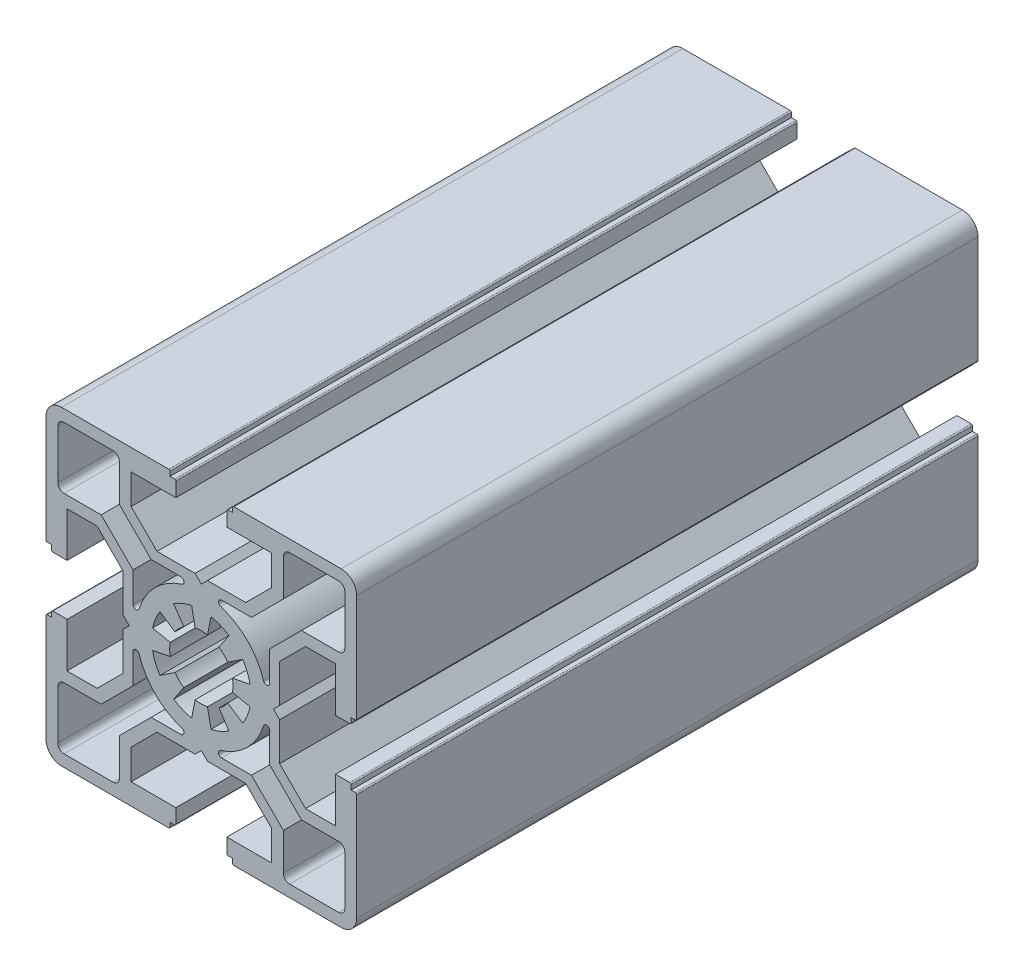
from build123d import *

# Parameters (mm, degrees)
EXTRUDE_1_DEPTH = 100


with BuildPart() as part:
    # 草图1 → 凸台-拉伸1 (new body)
    with BuildSketch(Plane.XY):
        with BuildLine():
            Line((-5.25, 25), (-22.5, 25))
            ThreePointArc((-22.5, 25), (-24.267766953, 24.267766953), (-25, 22.5))
            Line((-25, 22.5), (-25, 5.25))
            ThreePointArc((-25, 5.25), (-24.941421356, 5.108578644), (-24.8, 5.05))
            Line((-24.8, 5.05), (-24.1, 5.05))
            Line((-24.1, 5.05), (-24.1, 4.3))
            ThreePointArc((-24.1, 4.3), (-24.041421356, 4.158578644), (-23.9, 4.1))
            Line((-23.9, 4.1), (-21.6, 4.1))
            Line((-21.6, 4.1), (-21.6, 11.3))
            Line((-21.6, 11.3), (-16.769848481, 11.3))
            Line((-16.769848481, 11.3), (-12.6, 7.130151519))
            Line((-12.6, 7.130151519), (-12.6, 1))
            Line((-12.6, 1), (-11.6, 0))
            Line((-11.6, 0), (-12.6, -1))
            Line((-12.6, -1), (-12.6, -7.130151519))
            Line((-12.6, -7.130151519), (-16.769848481, -11.3))
            Line((-16.769848481, -11.3), (-21.6, -11.3))
            Line((-21.6, -11.3), (-21.6, -4.1))
            Line((-21.6, -4.1), (-23.9, -4.1))
            ThreePointArc((-23.9, -4.1), (-24.041421356, -4.158578644), (-24.1, -4.3))
            Line((-24.1, -4.3), (-24.1, -5.05))
            Line((-24.1, -5.05), (-24.8, -5.05))
            ThreePointArc((-24.8, -5.05), (-24.941421356, -5.108578644), (-25, -5.25))
            Line((-25, -5.25), (-25, -22.5))
            ThreePointArc((-25, -22.5), (-24.267766953, -24.267766953), (-22.5, -25))
            Line((-22.5, -25), (-5.25, -25))
            ThreePointArc((-5.25, -25), (-5.108578644, -24.941421356), (-5.05, -24.8))
            Line((-5.05, -24.8), (-5.05, -24.1))
            Line((-5.05, -24.1), (-4.3, -24.1))
            ThreePointArc((-4.3, -24.1), (-4.158578644, -24.041421356), (-4.1, -23.9))
            Line((-4.1, -23.9), (-4.1, -21.6))
            Line((-4.1, -21.6), (-11.3, -21.6))
            Line((-11.3, -21.6), (-11.3, -16.769848481))
            Line((-11.3, -16.769848481), (-7.130151519, -12.6))
            Line((-7.130151519, -12.6), (-1, -12.6))
            Line((-1, -12.6), (0, -11.6))
            Line((0, -11.6), (1, -12.6))
            Line((1, -12.6), (7.130151519, -12.6))
            Line((7.130151519, -12.6), (11.3, -16.769848481))
            Line((11.3, -16.769848481), (11.3, -21.6))
            Line((11.3, -21.6), (4.1, -21.6))
            Line((4.1, -21.6), (4.1, -23.9))
            ThreePointArc((4.1, -23.9), (4.158578644, -24.041421356), (4.3, -24.1))
            Line((4.3, -24.1), (5.05, -24.1))
            Line((5.05, -24.1), (5.05, -24.8))
            ThreePointArc((5.05, -24.8), (5.108578644, -24.941421356), (5.25, -25))
            Line((5.25, -25), (22.5, -25))
            ThreePointArc((22.5, -25), (24.267766953, -24.267766953), (25, -22.5))
            Line((25, -22.5), (25, -5.25))
            ThreePointArc((25, -5.25), (24.941421356, -5.108578644), (24.8, -5.05))
            Line((24.8, -5.05), (24.1, -5.05))
            Line((24.1, -5.05), (24.1, -4.3))
            ThreePointArc((24.1, -4.3), (24.041421356, -4.158578644), (23.9, -4.1))
            Line((23.9, -4.1), (21.6, -4.1))
            Line((21.6, -4.1), (21.6, -11.3))
            Line((21.6, -11.3), (16.769848481, -11.3))
            Line((16.769848481, -11.3), (12.6, -7.130151519))
            Line((12.6, -7.130151519), (12.6, -1))
            Line((12.6, -1), (11.6, 0))
            Line((11.6, 0), (12.6, 1))
            Line((12.6, 1), (12.6, 7.130151519))
            Line((12.6, 7.130151519), (16.769848481, 11.3))
            Line((16.769848481, 11.3), (21.6, 11.3))
            Line((21.6, 11.3), (21.6, 4.1))
            Line((21.6, 4.1), (23.9, 4.1))
            ThreePointArc((23.9, 4.1), (24.041421356, 4.158578644), (24.1, 4.3))
            Line((24.1, 4.3), (24.1, 5.05))
            Line((24.1, 5.05), (24.8, 5.05))
            ThreePointArc((24.8, 5.05), (24.941421356, 5.108578644), (25, 5.25))
            Line((25, 5.25), (25, 22.5))
            ThreePointArc((25, 22.5), (24.267766953, 24.267766953), (22.5, 25))
            Line((22.5, 25), (5.25, 25))
            ThreePointArc((5.25, 25), (5.108578644, 24.941421356), (5.05, 24.8))
            Line((5.05, 24.8), (5.05, 24.1))
            Line((5.05, 24.1), (4.3, 24.1))
            ThreePointArc((4.3, 24.1), (4.158578644, 24.041421356), (4.1, 23.9))
            Line((4.1, 23.9), (4.1, 21.6))
            Line((4.1, 21.6), (11.3, 21.6))
            Line((11.3, 21.6), (11.3, 16.769848481))
            Line((11.3, 16.769848481), (7.130151519, 12.6))
            Line((7.130151519, 12.6), (1, 12.6))
            Line((1, 12.6), (0, 11.6))
            Line((0, 11.6), (-1, 12.6))
            Line((-1, 12.6), (-7.130151519, 12.6))
            Line((-7.130151519, 12.6), (-11.3, 16.769848481))
            Line((-11.3, 16.769848481), (-11.3, 21.6))
            Line((-11.3, 21.6), (-4.1, 21.6))
            Line((-4.1, 21.6), (-4.1, 23.9))
            ThreePointArc((-4.1, 23.9), (-4.158578644, 24.041421356), (-4.3, 24.1))
            Line((-4.3, 24.1), (-5.05, 24.1))
            Line((-5.05, 24.1), (-5.05, 24.8))
            ThreePointArc((-5.05, 24.8), (-5.108578644, 24.941421356), (-5.25, 25))
        make_face()
        with BuildLine():
            Line((2.833408188, 4.240495023), (4.444561864, 6.651756898))
            ThreePointArc((4.444561864, 6.651756898), (3.061467459, 7.39103626), (1.560722576, 7.846282243))
            Line((1.560722576, 7.846282243), (0.994960642, 5.00200493))
            ThreePointArc((0.994960642, 5.00200493), (0, 5.1), (-0.994960642, 5.00200493))
            Line((-0.994960642, 5.00200493), (-1.560722576, 7.846282243))
            ThreePointArc((-1.560722576, 7.846282243), (-3.061467459, 7.39103626), (-4.444561864, 6.651756898))
            Line((-4.444561864, 6.651756898), (-2.833408188, 4.240495023))
            ThreePointArc((-2.833408188, 4.240495023), (-3.606244584, 3.606244584), (-4.240495023, 2.833408188))
            Line((-4.240495023, 2.833408188), (-6.651756898, 4.444561864))
            ThreePointArc((-6.651756898, 4.444561864), (-7.39103626, 3.061467459), (-7.846282243, 1.560722576))
            Line((-7.846282243, 1.560722576), (-5.00200493, 0.994960642))
            ThreePointArc((-5.00200493, 0.994960642), (-5.1, 0), (-5.00200493, -0.994960642))
            Line((-5.00200493, -0.994960642), (-7.846282243, -1.560722576))
            ThreePointArc((-7.846282243, -1.560722576), (-7.39103626, -3.061467459), (-6.651756898, -4.444561864))
            Line((-6.651756898, -4.444561864), (-4.240495023, -2.833408188))
            ThreePointArc((-4.240495023, -2.833408188), (-3.606244584, -3.606244584), (-2.833408188, -4.240495023))
            Line((-2.833408188, -4.240495023), (-4.444561864, -6.651756898))
            ThreePointArc((-4.444561864, -6.651756898), (-3.061467459, -7.39103626), (-1.560722576, -7.846282243))
            Line((-1.560722576, -7.846282243), (-0.994960642, -5.00200493))
            ThreePointArc((-0.994960642, -5.00200493), (0, -5.1), (0.994960642, -5.00200493))
            Line((0.994960642, -5.00200493), (1.560722576, -7.846282243))
            ThreePointArc((1.560722576, -7.846282243), (3.061467459, -7.39103626), (4.444561864, -6.651756898))
            Line((4.444561864, -6.651756898), (2.833408188, -4.240495023))
            ThreePointArc((2.833408188, -4.240495023), (3.606244584, -3.606244584), (4.240495023, -2.833408188))
            Line((4.240495023, -2.833408188), (6.651756898, -4.444561864))
            ThreePointArc((6.651756898, -4.444561864), (7.39103626, -3.061467459), (7.846282243, -1.560722576))
            Line((7.846282243, -1.560722576), (5.00200493, -0.994960642))
            ThreePointArc((5.00200493, -0.994960642), (5.1, 0), (5.00200493, 0.994960642))
            Line((5.00200493, 0.994960642), (7.846282243, 1.560722576))
            ThreePointArc((7.846282243, 1.560722576), (7.39103626, 3.061467459), (6.651756898, 4.444561864))
            Line((6.651756898, 4.444561864), (4.240495023, 2.833408188))
            ThreePointArc((4.240495023, 2.833408188), (3.606244584, 3.606244584), (2.833408188, 4.240495023))
        make_face(mode=Mode.SUBTRACT)
        with BuildLine():
            Line((3.278719262, -11), (8.075735931, -11))
            Line((8.075735931, -11), (13.2, -16.124264069))
            Line((13.2, -16.124264069), (13.2, -22.1))
            ThreePointArc((13.2, -22.1), (13.492893219, -22.807106781), (14.2, -23.1))
            Line((14.2, -23.1), (22.1, -23.1))
            ThreePointArc((22.1, -23.1), (22.807106781, -22.807106781), (23.1, -22.1))
            Line((23.1, -22.1), (23.1, -14.2))
            ThreePointArc((23.1, -14.2), (22.807106781, -13.492893219), (22.1, -13.2))
            Line((22.1, -13.2), (16.124264069, -13.2))
            Line((16.124264069, -13.2), (11, -8.075735931))
            Line((11, -8.075735931), (11, -3.278719262))
            ThreePointArc((11, -3.278719262), (10.575377836, -2.784433736), (10.022727273, -3.129686568))
            ThreePointArc((10.022727273, -3.129686568), (7.424621202, -7.424621202), (3.129686568, -10.022727273))
            ThreePointArc((3.129686568, -10.022727273), (2.784433736, -10.575377836), (3.278719262, -11))
        make_face(mode=Mode.SUBTRACT)
        with BuildLine():
            Line((-8.075735931, 11), (-13.2, 16.124264069))
            Line((-13.2, 16.124264069), (-13.2, 22.1))
            ThreePointArc((-13.2, 22.1), (-13.492893219, 22.807106781), (-14.2, 23.1))
            Line((-14.2, 23.1), (-22.1, 23.1))
            ThreePointArc((-22.1, 23.1), (-22.807106781, 22.807106781), (-23.1, 22.1))
            Line((-23.1, 22.1), (-23.1, 14.2))
            ThreePointArc((-23.1, 14.2), (-22.807106781, 13.492893219), (-22.1, 13.2))
            Line((-22.1, 13.2), (-16.124264069, 13.2))
            Line((-16.124264069, 13.2), (-11, 8.075735931))
            Line((-11, 8.075735931), (-11, 3.278719262))
            ThreePointArc((-11, 3.278719262), (-10.575377836, 2.784433736), (-10.022727273, 3.129686568))
            ThreePointArc((-10.022727273, 3.129686568), (-7.424621202, 7.424621202), (-3.129686568, 10.022727273))
            ThreePointArc((-3.129686568, 10.022727273), (-2.784433736, 10.575377836), (-3.278719262, 11))
            Line((-3.278719262, 11), (-8.075735931, 11))
        make_face(mode=Mode.SUBTRACT)
        with BuildLine():
            Line((13.2, 22.1), (13.2, 16.124264069))
            Line((13.2, 16.124264069), (8.075735931, 11))
            Line((8.075735931, 11), (3.278719262, 11))
            ThreePointArc((3.278719262, 11), (2.784433736, 10.575377836), (3.129686568, 10.022727273))
            ThreePointArc((3.129686568, 10.022727273), (7.424621202, 7.424621202), (10.022727273, 3.129686568))
            ThreePointArc((10.022727273, 3.129686568), (10.575377836, 2.784433736), (11, 3.278719262))
            Line((11, 3.278719262), (11, 8.075735931))
            Line((11, 8.075735931), (16.124264069, 13.2))
            Line((16.124264069, 13.2), (22.1, 13.2))
            ThreePointArc((22.1, 13.2), (22.807106781, 13.492893219), (23.1, 14.2))
            Line((23.1, 14.2), (23.1, 22.1))
            ThreePointArc((23.1, 22.1), (22.807106781, 22.807106781), (22.1, 23.1))
            Line((22.1, 23.1), (14.2, 23.1))
            ThreePointArc((14.2, 23.1), (13.492893219, 22.807106781), (13.2, 22.1))
        make_face(mode=Mode.SUBTRACT)
        with BuildLine():
            Line((-16.124264069, -13.2), (-22.1, -13.2))
            ThreePointArc((-22.1, -13.2), (-22.807106781, -13.492893219), (-23.1, -14.2))
            Line((-23.1, -14.2), (-23.1, -22.1))
            ThreePointArc((-23.1, -22.1), (-22.807106781, -22.807106781), (-22.1, -23.1))
            Line((-22.1, -23.1), (-14.2, -23.1))
            ThreePointArc((-14.2, -23.1), (-13.492893219, -22.807106781), (-13.2, -22.1))
            Line((-13.2, -22.1), (-13.2, -16.124264069))
            Line((-13.2, -16.124264069), (-8.075735931, -11))
            Line((-8.075735931, -11), (-3.278719262, -11))
            ThreePointArc((-3.278719262, -11), (-2.784433736, -10.575377836), (-3.129686568, -10.022727273))
            ThreePointArc((-3.129686568, -10.022727273), (-7.424621202, -7.424621202), (-10.022727273, -3.129686568))
            ThreePointArc((-10.022727273, -3.129686568), (-10.575377836, -2.784433736), (-11, -3.278719262))
            Line((-11, -3.278719262), (-11, -8.075735931))
            Line((-11, -8.075735931), (-16.124264069, -13.2))
        make_face(mode=Mode.SUBTRACT)
    extrude(amount=EXTRUDE_1_DEPTH)


solid = part.part
